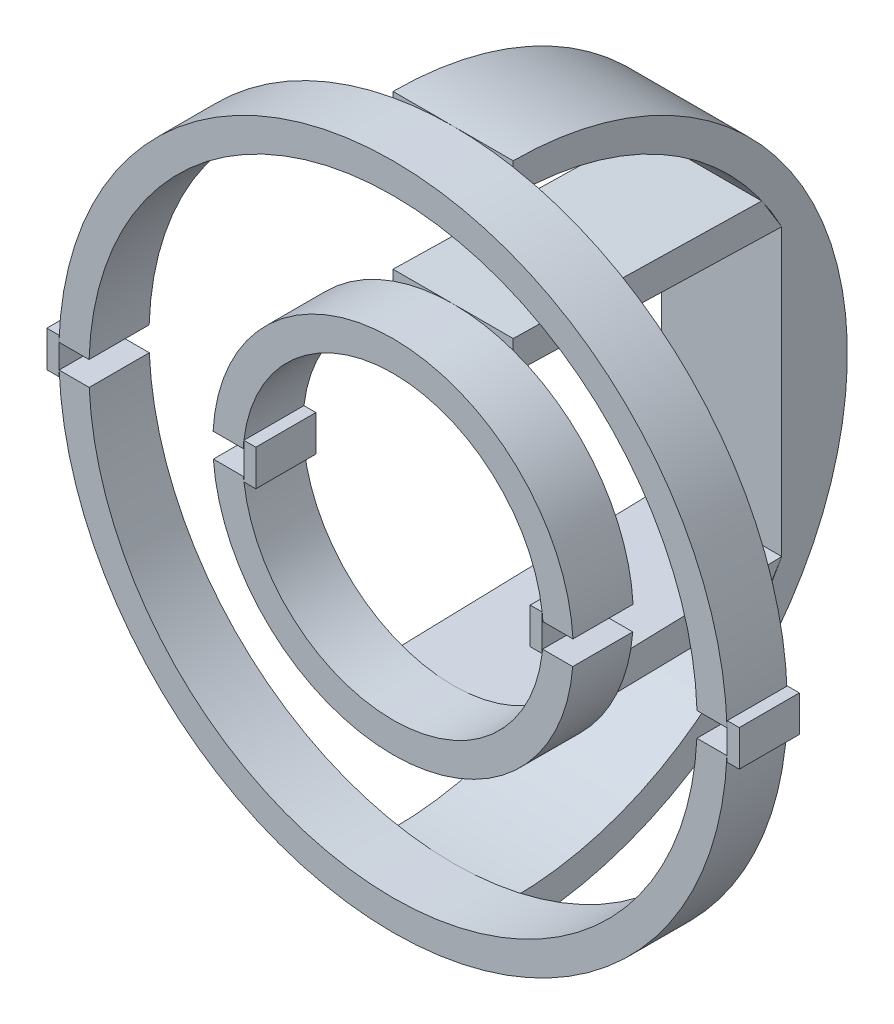
from build123d import *

# Parameters (mm, degrees)
SKETCH1_W             = 0.4
SKETCH1_H             = 1.2
BOSS_EXTRUDE6_DEPTH   = 2
BOSS_EXTRUDE6_2_DEPTH = 2
BOSS_EXTRUDE6_3_DEPTH = 2
BOSS_EXTRUDE6_4_DEPTH = 2
BOSS_EXTRUDE6_5_DEPTH = 2
BOSS_EXTRUDE9_DEPTH   = 2


with BuildPart() as part:
    # Sketch1 → Boss-Extrude6 (new body)
    with BuildSketch(Plane.XY):
        with Locations((11.325734145, -0.052379551)):
            Rectangle(SKETCH1_W, SKETCH1_H)
    extrude(amount=BOSS_EXTRUDE6_DEPTH)


with BuildPart() as body_2:
    # Sketch1 → Boss-Extrude6 2 (new body)
    with BuildSketch(Plane.XY):
        with BuildLine():
            Line((10.119474502, 0.334455981), (11.119971412, 0.334455981))
            ThreePointArc((11.119971412, 0.334455981), (0, 11.125), (-11.119971412, 0.334455981))
            Line((-11.119971412, 0.334455981), (-10.119474502, 0.334455981))
            ThreePointArc((-10.119474502, 0.334455981), (0, 10.125), (10.119474502, 0.334455981))
        make_face()
    extrude(amount=BOSS_EXTRUDE6_2_DEPTH)



with BuildPart() as body_3:
    # Sketch1 → Boss-Extrude6 3 (new body)
    with BuildSketch(Plane.XY):
        with BuildLine():
            ThreePointArc((-11.115255002, -0.465544019), (0, -11.125), (11.115255002, -0.465544019))
            Line((11.115255002, -0.465544019), (10.11429156, -0.465544019))
            ThreePointArc((10.11429156, -0.465544019), (0, -10.125), (-10.11429156, -0.465544019))
            Line((-10.11429156, -0.465544019), (-11.115255002, -0.465544019))
        make_face()
    extrude(amount=BOSS_EXTRUDE6_3_DEPTH)


with BuildPart() as body_4:
    # Sketch1 → Boss-Extrude6 4 (new body)
    with BuildSketch(Plane.XY):
        with BuildLine():
            Line((-4.96832272, 0.561933585), (-4.96832272, -0.561933585))
            ThreePointArc((-4.96832272, -0.561933585), (-4.973534725, -0.513762924), (-4.978279699, -0.465544019))
            Line((-4.978279699, -0.465544019), (-5.981911799, -0.465544019))
            ThreePointArc((-5.981911799, -0.465544019), (0, -6), (5.981911799, -0.465544019))
            Line((5.981911799, -0.465544019), (4.978279699, -0.465544019))
            ThreePointArc((4.978279699, -0.465544019), (4.972008711, -0.528326962), (4.964945975, -0.591025774))
            Line((4.964945975, -0.591025774), (4.964945975, 0.591025774))
            ThreePointArc((4.964945975, 0.591025774), (4.978526751, 0.462894577), (4.988801379, 0.334455981))
            Line((4.988801379, 0.334455981), (5.990671014, 0.334455981))
            ThreePointArc((5.990671014, 0.334455981), (0, 6), (-5.990671014, 0.334455981))
            Line((-5.990671014, 0.334455981), (-4.988801379, 0.334455981))
            ThreePointArc((-4.988801379, 0.334455981), (-4.979861102, 0.44831173), (-4.96832272, 0.561933585))
        make_face()
        with BuildLine():
            ThreePointArc((4.963778954, -0.600748279), (0.007811541, -4.999993898), (-4.961877617, -0.616255233))
            Line((-4.961877617, -0.616255233), (-4.56832272, -0.616255233))
            Line((-4.56832272, -0.616255233), (-4.56832272, 0.583744767))
            Line((-4.56832272, 0.583744767), (-4.965807291, 0.583744767))
            ThreePointArc((-4.965807291, 0.583744767), (-0.007808307, 4.999993903), (4.963959848, 0.599251721))
            Line((4.963959848, 0.599251721), (4.564945975, 0.599251721))
            Line((4.564945975, 0.599251721), (4.564945975, -0.600748279))
            Line((4.564945975, -0.600748279), (4.963778954, -0.600748279))
        make_face(mode=Mode.SUBTRACT)
    extrude(amount=BOSS_EXTRUDE6_4_DEPTH)


with BuildPart() as body_5:
    # Sketch1 → Boss-Extrude6 5 (new body)
    with BuildSketch(Plane.XY):
        with Locations((-11.324786406, -0.061923137)):
            Rectangle(SKETCH1_W, SKETCH1_H)
    extrude(amount=BOSS_EXTRUDE6_5_DEPTH)


with BuildPart() as body_2_1:
    add(body_2.part)

    add(body_3.part)  # Boss-Extrude9 merges body 3

    add(body_4.part)  # Boss-Extrude9 merges body 4
    # Sketch7 → Boss-Extrude9 (add, symmetric)
    with BuildSketch(Plane(origin=(0, 0, 0), x_dir=(0, 0, -1), z_dir=(1, 0, 0))):
        Polygon((8.939520925, -4.754007849), (8.278345179, -5.829633445), (0, -6), (0, -5), align=None)
        Polygon((8.278345179, 5.829633445), (8.939520925, 4.754007849), (0, 5), (0, 6), align=None)
        with BuildLine():
            ThreePointArc((0, 10.125), (10.125, 0), (0, -10.125))
            Line((0, -10.125), (0, -11.125))
            ThreePointArc((0, -11.125), (11.125, 0), (0, 11.125))
            Line((0, 11.125), (0, 10.125))
        make_face()
        with BuildLine():
            ThreePointArc((8.939520925, -4.754007849), (10.125, 0), (8.939520925, 4.754007849))
            Line((8.939520925, 4.754007849), (8.939520925, -4.754007849))
        make_face()
    extrude(amount=BOSS_EXTRUDE9_DEPTH, both=True)


solid = Compound([part.part, body_5.part, body_2_1.part])
